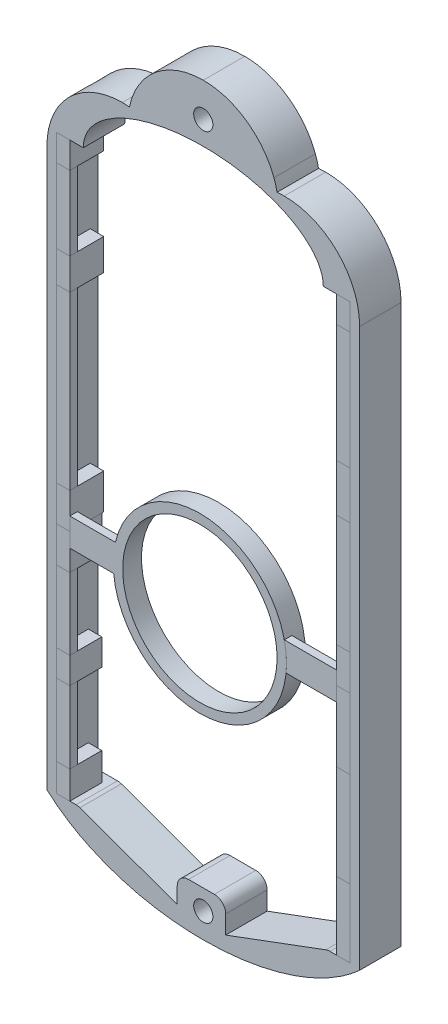
from build123d import *

# Parameters (mm, degrees)
SKETCH_1_R          = 2.55
EXTRUDE_1_DEPTH     = 11
CUT_EXTRUDE_1_DEPTH = 12
SKETCH_3_W          = 3.57346696
SKETCH_3_H          = 6.992054996
EXTRUDE_2_DEPTH     = 9
EXTRUDE_2_2_DEPTH   = 9
SKETCH_3_H_2        = 8.312138205
EXTRUDE_2_3_DEPTH   = 9
SKETCH_3_H_3        = 12.586021109
EXTRUDE_2_4_DEPTH   = 9
EXTRUDE_2_5_DEPTH   = 9
EXTRUDE_2_6_DEPTH   = 9
SKETCH_3_3_W        = 3.57346696
SKETCH_3_3_H        = 19.695806799
SKETCH_3_3_H_2      = 31.259766677
SKETCH_3_3_H_3      = 29.757407966
SKETCH_3_3_H_4      = 25.595250748
SKETCH_3_3_H_5      = 20
EXTRUDE_3_DEPTH     = 2
EXTRUDE_4_DEPTH     = 2
EXTRUDE_4_2_DEPTH   = 2
SKETCH_3_5_R        = 23
SKETCH_3_5_R_2      = 20.5
EXTRUDE_5_DEPTH     = 5
SKETCH_3_6_W        = 3.57346696
SKETCH_3_6_H        = 18.699822207
EXTRUDE_6_DEPTH     = 8.5
SKETCH_3_6_H_2      = 18.12494327
EXTRUDE_6_2_DEPTH   = 8.5
SKETCH_3_6_H_3      = 9.445483778
EXTRUDE_6_3_DEPTH   = 8.5
SKETCH_3_6_H_4      = 6.980918364
EXTRUDE_6_4_DEPTH   = 8.5
SKETCH_3_6_H_5      = 7.401231098
EXTRUDE_6_5_DEPTH   = 8.5
SKETCH_3_7_W        = 3.57346696
SKETCH_3_7_H        = 19.029379681
EXTRUDE_7_DEPTH     = 2
SKETCH_3_7_H_2      = 19.142987079
EXTRUDE_7_2_DEPTH   = 2
SKETCH_3_7_H_3      = 25.175234523
EXTRUDE_7_3_DEPTH   = 2


with BuildPart() as part:
    # 草图1 → 凸台-拉伸1 (new body)
    with BuildSketch(Plane.XY):
        with BuildLine():
            Line((-41.500782935, 68.140791219), (-41.500782935, -79.859208781))
            add(Edge.make_bspline(
                [(-41.500782935, -79.859208781), (-38.389280352, -82.702596808), (-34.568690991, -85.207331949), (-30.197769157, -87.278135781)],
                knots=[11, 11, 11, 11, 12, 12, 12, 12], degree=3))
            add(Edge.make_bspline(
                [(-30.197769157, -87.278135781), (-21.780496549, -91.268051585), (-11.324158051, -93.62813578), (0, -93.62813578)],
                knots=[12, 12, 12, 12, 13, 13, 13, 13], degree=3))
            add(Edge.make_bspline(
                [(0, -93.62813578), (11.324158051, -93.62813578), (21.780496549, -91.268051585), (30.197769157, -87.278135781)],
                knots=[13, 13, 13, 13, 14, 14, 14, 14], degree=3))
            add(Edge.make_bspline(
                [(30.197769157, -87.278135781), (34.568690991, -85.207331949), (38.389280352, -82.702596808), (41.500782935, -79.859208781)],
                knots=[14, 14, 14, 14, 15, 15, 15, 15], degree=3))
            Line((41.500782935, -79.859208781), (41.500782935, 68.140791219))
            add(Edge.make_bspline(
                [(41.500782935, 68.140791219), (41.500782935, 79.186262577), (32.547281215, 88.139764297), (21.501809857, 88.139764297)],
                knots=[0, 0, 0, 0, 1, 1, 1, 1], degree=3))
            add(Edge.make_bspline(
                [(21.501809857, 88.139764297), (20.859751717, 88.139764297), (20.221224801, 88.108026355), (19.593270021, 88.04803863)],
                knots=[1, 1, 1, 1, 2, 2, 2, 2], degree=3))
            add(Edge.make_bspline(
                [(19.593270021, 88.04803863), (19.388674413, 89.04640577), (19.106434966, 90.020075881), (18.760719634, 90.961986519)],
                knots=[2, 2, 2, 2, 3, 3, 3, 3], degree=3))
            add(Edge.make_bspline(
                [(18.760719634, 90.961986519), (15.938497412, 98.581999436), (8.604255165, 104.014764294), (0, 104.014764294)],
                knots=[3, 3, 3, 3, 4, 4, 4, 4], degree=3))
            add(Edge.make_bspline(
                [(0, 104.014764294), (-8.604255165, 104.014764294), (-15.938497412, 98.581999436), (-18.760719634, 90.961986519)],
                knots=[4, 4, 4, 4, 5, 5, 5, 5], degree=3))
            add(Edge.make_bspline(
                [(-18.760719634, 90.961986519), (-19.106456498, 90.020075881), (-19.388674413, 89.04640577), (-19.593270021, 88.04803863)],
                knots=[5, 5, 5, 5, 6, 6, 6, 6], degree=3))
            add(Edge.make_bspline(
                [(-19.593270021, 88.04803863), (-20.221224801, 88.108026355), (-20.856220494, 88.139764297), (-21.498278634, 88.139764297)],
                knots=[6, 6, 6, 6, 7, 7, 7, 7], degree=3))
            add(Edge.make_bspline(
                [(-21.498278634, 88.139764297), (-32.547281215, 88.139764297), (-41.500782935, 79.186262577), (-41.500782935, 68.140791219)],
                knots=[7, 7, 7, 7, 8, 8, 8, 8], degree=3))
        make_face()
        with Locations((0, 95)):
            Circle(SKETCH_1_R, mode=Mode.SUBTRACT)
        with Locations((0, -87)):
            Circle(SKETCH_1_R, mode=Mode.SUBTRACT)
    extrude(amount=EXTRUDE_1_DEPTH)

    # 草图2 → 切除-拉伸1 (cut)
    with BuildSketch(Plane.XY.offset(11)):
        with BuildLine():
            Line((-39, 72.56175603), (-31.85306608, 72.56175603))
            add(Edge.make_bspline(
                [(31.85306608, 72.56175603), (31.85306608, 88.82119273), (0, 88.82119273), (-31.85306608, 88.82119273), (-31.85306608, 72.56175603)],
                knots=[0, 0, 0, 1.570796327, 1.570796327, 3.141592654, 3.141592654, 3.141592654], degree=2, weights=[1, 0.707106781, 1, 0.707106781, 1]))
            Line((31.85306608, 72.56175603), (39, 72.56175603))
            Line((39, 72.56175603), (39, -79.43824397))
            Line((39, -79.43824397), (33.590068299, -79.43824397))
            ThreePointArc((33.590068299, -79.43824397), (33.058093845, -79.485786827), (32.542980448, -79.626908516))
            Line((32.542980448, -79.626908516), (5.947078237, -89.532608684))
            Line((5.947078237, -89.532608684), (5.947078237, -84.669920089))
            ThreePointArc((5.947078237, -84.669920089), (5.06839858, -82.548599745), (2.947078237, -81.669920089))
            Line((2.947078237, -81.669920089), (-3.919139465, -81.669920089))
            ThreePointArc((-3.919139465, -81.669920089), (-6.040459809, -82.548599745), (-6.919139465, -84.669920089))
            Line((-6.919139465, -84.669920089), (-6.919139465, -88.936950457))
            Line((-6.919139465, -88.936950457), (-32.753744515, -79.616285846))
            ThreePointArc((-32.753744515, -79.616285846), (-33.255075458, -79.483089628), (-33.771856663, -79.43824397))
            Line((-33.771856663, -79.43824397), (-39, -79.43824397))
            Line((-39, -79.43824397), (-39, 72.56175603))
        make_face()
    extrude(amount=-CUT_EXTRUDE_1_DEPTH, mode=Mode.SUBTRACT)


with BuildPart() as body_2:
    # 草图3 → 凸台-拉伸2 (new body)
    with BuildSketch(Plane.XY.offset(11)):
        with Locations((37.21326652, 69.065728532)):
            Rectangle(SKETCH_3_W, SKETCH_3_H)
    extrude(amount=-EXTRUDE_2_DEPTH)


with BuildPart() as body_3:
    # 草图3 → Extrude 2 2 (new body)
    with BuildSketch(Plane.XY.offset(11)):
        with Locations((-37.21326652, 69.065728532)):
            Rectangle(SKETCH_3_W, SKETCH_3_H)
    extrude(amount=-EXTRUDE_2_2_DEPTH)


with BuildPart() as body_4:
    # 草图3 → Extrude 2 3 (new body)
    with BuildSketch(Plane.XY.offset(11)):
        with Locations((-37.21326652, 41.717825133)):
            Rectangle(SKETCH_3_W, SKETCH_3_H_2)
    extrude(amount=-EXTRUDE_2_3_DEPTH)


with BuildPart() as body_5:
    # 草图3 → Extrude 2 4 (new body)
    with BuildSketch(Plane.XY.offset(11)):
        with Locations((37.21326652, 28.016923803)):
            Rectangle(SKETCH_3_W, SKETCH_3_H_3)
    extrude(amount=-EXTRUDE_2_4_DEPTH)


with BuildPart() as body_6:
    # 草图3 → Extrude 2 5 (new body)
    with BuildSketch(Plane.XY.offset(11)):
        Polygon((35.42653304, -13.881647454), (35.42653304, -17.43824397), (39, -17.43824397), (39, -8.033494718), (35.42653304, -8.033494718), align=None)
    extrude(amount=-EXTRUDE_2_5_DEPTH)


with BuildPart() as body_7:
    # 草图3 → Extrude 2 6 (new body)
    with BuildSketch(Plane.XY.offset(11)):
        Polygon((-35.42653304, -17.43824397), (-35.42653304, -13.881647454), (-35.42653304, -8.033494718), (-39, -8.033494718), (-39, -17.43824397), align=None)
    extrude(amount=-EXTRUDE_2_6_DEPTH)


with BuildPart() as body_8:
    # 草图3<3> → 凸台-拉伸3 (new body)
    with BuildSketch(Plane.XY.offset(11)):
        with Locations((-37.21326652, 55.721797635)):
            Rectangle(SKETCH_3_3_W, SKETCH_3_3_H)
        with Locations((37.21326652, 49.939817696)):
            Rectangle(SKETCH_3_3_W, SKETCH_3_3_H_2)
        with Locations((37.21326652, 6.845209265)):
            Rectangle(SKETCH_3_3_W, SKETCH_3_3_H_3)
        with Locations((-37.21326652, 4.764130656)):
            Rectangle(SKETCH_3_3_W, SKETCH_3_3_H_4)
        with Locations((-37.21326652, 27.56175603)):
            Rectangle(SKETCH_3_3_W, SKETCH_3_3_H_5)
    extrude(amount=-EXTRUDE_3_DEPTH)


with BuildPart() as body_9:
    # 草图3<4> → 凸台-拉伸4 (new body)
    with BuildSketch(Plane.XY.offset(11)):
        with BuildLine():
            Line((35.42653304, -21.282092163), (35.42653304, -17.43824397))
            Line((35.42653304, -17.43824397), (35.42653304, -13.881647454))
            Line((35.42653304, -13.881647454), (31.85306608, -13.881647454))
            Line((31.85306608, -13.881647454), (21.516738038, -13.881647454))
            ThreePointArc((21.516738038, -13.881647454), (21.950689632, -16.429930259), (22.09595179, -19.010813469))
            ThreePointArc((22.09595179, -19.010813469), (22.067829459, -20.147843073), (21.98353124, -21.282092163))
            Line((21.98353124, -21.282092163), (31.93094233, -21.282092163))
            Line((31.93094233, -21.282092163), (35.42653304, -21.282092163))
        make_face()
    extrude(amount=-EXTRUDE_4_DEPTH)


with BuildPart() as body_10:
    # 草图3<4> → Extrude 4 2 (new body)
    with BuildSketch(Plane.XY.offset(11)):
        with BuildLine():
            ThreePointArc((-23.791627661, -21.282092163), (-23.858430059, -17.562934345), (-23.324834459, -13.881647454))
            Line((-23.324834459, -13.881647454), (-31.85306608, -13.881647454))
            Line((-31.85306608, -13.881647454), (-35.42653304, -13.881647454))
            Line((-35.42653304, -13.881647454), (-35.42653304, -17.43824397))
            Line((-35.42653304, -17.43824397), (-35.42653304, -21.282092163))
            Line((-35.42653304, -21.282092163), (-31.77518983, -21.282092163))
            Line((-31.77518983, -21.282092163), (-23.791627661, -21.282092163))
        make_face()
    extrude(amount=-EXTRUDE_4_2_DEPTH)

    # 草图3<5> → 凸台-拉伸5 (add)
    with BuildSketch(Plane.XY.offset(11)):
        with Locations((-0.90404821, -19.010813469)):
            Circle(SKETCH_3_5_R)
        with Locations((-0.90404821, -19.010813469)):
            Circle(SKETCH_3_5_R_2, mode=Mode.SUBTRACT)
    extrude(amount=-EXTRUDE_5_DEPTH)


with BuildPart() as body_11:
    # 草图3<6> → 凸台-拉伸6 (new body)
    with BuildSketch(Plane.XY.offset(11)):
        with Locations((37.21326652, -26.788155074)):
            Rectangle(SKETCH_3_6_W, SKETCH_3_6_H)
    extrude(amount=-EXTRUDE_6_DEPTH)


with BuildPart() as body_12:
    # 草图3<6> → Extrude 6 2 (new body)
    with BuildSketch(Plane.XY.offset(11)):
        with Locations((37.21326652, -70.375772335)):
            Rectangle(SKETCH_3_6_W, SKETCH_3_6_H_2)
    extrude(amount=-EXTRUDE_6_2_DEPTH)


with BuildPart() as body_13:
    # 草图3<6> → Extrude 6 3 (new body)
    with BuildSketch(Plane.XY.offset(11)):
        with Locations((-37.21326652, -22.160985859)):
            Rectangle(SKETCH_3_6_W, SKETCH_3_6_H_3)
    extrude(amount=-EXTRUDE_6_3_DEPTH)


with BuildPart() as body_14:
    # 草图3<6> → Extrude 6 4 (new body)
    with BuildSketch(Plane.XY.offset(11)):
        with Locations((-37.21326652, -49.403566611)):
            Rectangle(SKETCH_3_6_W, SKETCH_3_6_H_4)
    extrude(amount=-EXTRUDE_6_4_DEPTH)


with BuildPart() as body_15:
    # 草图3<6> → Extrude 6 5 (new body)
    with BuildSketch(Plane.XY.offset(11)):
        with Locations((-37.21326652, -75.737628421)):
            Rectangle(SKETCH_3_6_W, SKETCH_3_6_H_5)
    extrude(amount=-EXTRUDE_6_5_DEPTH)


with BuildPart() as body_16:
    # 草图3<7> → 凸台-拉伸7 (new body)
    with BuildSketch(Plane.XY.offset(11)):
        with Locations((-37.21326652, -36.398417589)):
            Rectangle(SKETCH_3_7_W, SKETCH_3_7_H)
    extrude(amount=-EXTRUDE_7_DEPTH)


with BuildPart() as body_17:
    # 草图3<7> → Extrude 7 2 (new body)
    with BuildSketch(Plane.XY.offset(11)):
        with Locations((-37.21326652, -62.465519333)):
            Rectangle(SKETCH_3_7_W, SKETCH_3_7_H_2)
    extrude(amount=-EXTRUDE_7_2_DEPTH)


with BuildPart() as body_18:
    # 草图3<7> → Extrude 7 3 (new body)
    with BuildSketch(Plane.XY.offset(11)):
        with Locations((37.21326652, -48.725683438)):
            Rectangle(SKETCH_3_7_W, SKETCH_3_7_H_3)
    extrude(amount=-EXTRUDE_7_3_DEPTH)


solid = Compound([part.part, body_2.part, body_3.part, body_4.part, body_5.part, body_6.part, body_7.part, body_8.part, body_9.part, body_10.part, body_11.part, body_12.part, body_13.part, body_14.part, body_15.part, body_16.part, body_17.part, body_18.part])
